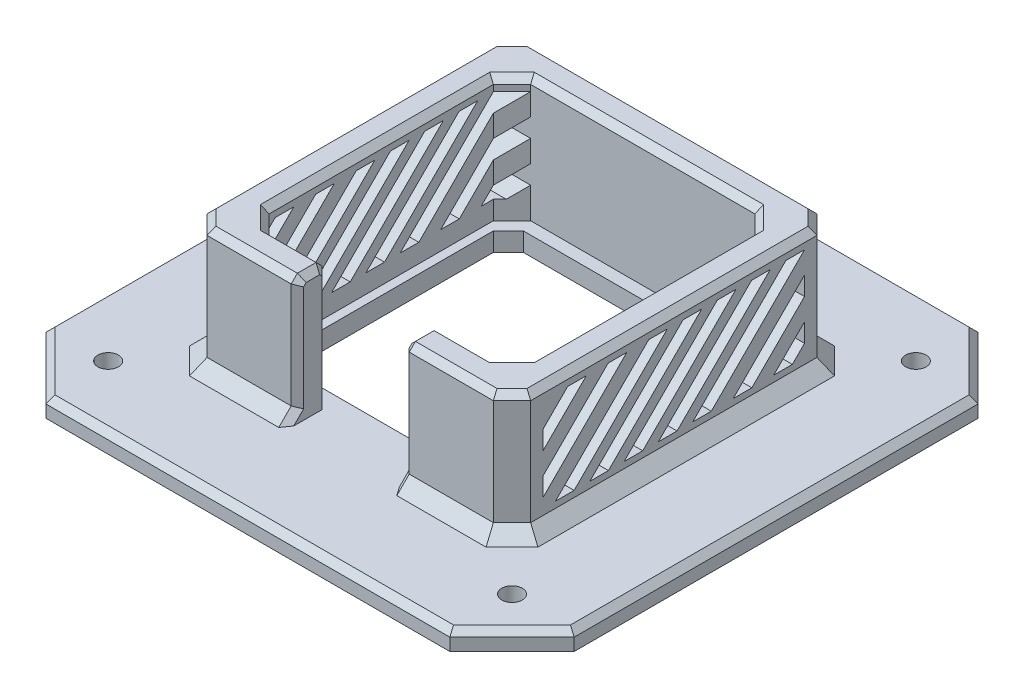
from build123d import *

# Parameters (mm, degrees)
SKETCH_1_W          = 85
SKETCH_1_H          = 85
EXTRUDE_1_DEPTH     = 3
SKETCH_2_W          = 52.08
SKETCH_2_H          = 52.08
SKETCH_2_W_2        = 42.08
SKETCH_2_H_2        = 42.08
EXTRUDE_2_DEPTH     = 20
CHAMFER_1_SIZE      = 3
CHAMFER_2_SIZE      = 2
CHAMFER_3_SIZE      = 1
CHAMFER_4_SIZE      = 10
CHAMFER_5_SIZE      = 1
CUT_EXTRUDE_1_REACH = 124.389
SKETCH_3_W          = 8.5
SKETCH_3_H          = 9.566393395
SKETCH_3_H_2        = 3
SKETCH_3_H_3        = 9.81159244
CHAMFER_6_SIZE      = 1
CUT_EXTRUDE_2_DEPTH = 10
CUT_EXTRUDE_4_DEPTH = 59
SKETCH_6_R          = 1.65
CUT_EXTRUDE_5_DEPTH = 10


with BuildPart() as part:
    # 草图1 → 凸台-拉伸1 (new body)
    with BuildSketch(Plane(origin=(0, 0, 0), x_dir=(1, 0, 0), z_dir=(0, 1, 0))):
        with Locations((42.5, 42.5)):
            Rectangle(SKETCH_1_W, SKETCH_1_H)
    extrude(amount=EXTRUDE_1_DEPTH)

    # 草图2 → 凸台-拉伸2 (add)
    with BuildSketch(Plane(origin=(0, 3, 0), x_dir=(1, 0, 0), z_dir=(0, 1, 0))):
        with Locations((42.5, 42.5)):
            Rectangle(SKETCH_2_W, SKETCH_2_H)
        with Locations((42.5, 42.5)):
            Rectangle(SKETCH_2_W_2, SKETCH_2_H_2, mode=Mode.SUBTRACT)
    extrude(amount=EXTRUDE_2_DEPTH)

    # 倒角1
    chamfer_1_edges = [part.edges().sort_by_distance(p)[0] for p in [
        (16.46, 13, -68.54),
        (16.46, 13, -16.46),
        (68.54, 13, -16.46),
        (68.54, 13, -68.54),
        (63.54, 13, -63.54),
        (21.46, 13, -63.54),
        (21.46, 13, -21.46),
        (63.54, 13, -21.46),
    ]]
    chamfer(chamfer_1_edges, length=CHAMFER_1_SIZE)

    # 倒角2
    chamfer_2_edges = [part.edges().sort_by_distance(p)[0] for p in [
        (68.54, 3, -42.5),
        (42.5, 3, -16.46),
        (42.5, 3, -68.54),
        (16.46, 3, -42.5),
        (67.04, 3, -17.96),
        (67.04, 3, -67.04),
        (17.96, 3, -17.96),
        (17.96, 3, -67.04),
    ]]
    chamfer(chamfer_2_edges, length=CHAMFER_2_SIZE)

    # 倒角3
    chamfer_3_edges = [part.edges().sort_by_distance(p)[0] for p in [
        (68.54, 23, -42.5),
        (42.5, 23, -16.46),
        (16.46, 23, -42.5),
        (42.5, 23, -68.54),
        (63.54, 23, -42.5),
        (42.5, 23, -21.46),
        (21.46, 23, -42.5),
        (42.5, 23, -63.54),
        (17.96, 23, -67.04),
        (17.96, 23, -17.96),
        (67.04, 23, -67.04),
        (67.04, 23, -17.96),
        (62.04, 23, -22.96),
        (22.96, 23, -22.96),
        (62.04, 23, -62.04),
        (22.96, 23, -62.04),
    ]]
    chamfer(chamfer_3_edges, length=CHAMFER_3_SIZE)

    # 倒角4
    chamfer_4_edges = [part.edges().sort_by_distance(p)[0] for p in [
        (0, 1.5, -85),
        (85, 1.5, -85),
        (85, 1.5, 0),
        (0, 1.5, 0),
    ]]
    chamfer(chamfer_4_edges, length=CHAMFER_4_SIZE)

    # 倒角5
    chamfer_5_edges = [part.edges().sort_by_distance(p)[0] for p in [
        (0, 3, -42.5),
        (42.5, 3, -85),
        (42.5, 3, 0),
        (85, 3, -42.5),
        (80, 3, -5),
        (80, 3, -80),
        (5, 3, -5),
        (5, 3, -80),
    ]]
    chamfer(chamfer_5_edges, length=CHAMFER_5_SIZE)

    # 切除-拉伸1: up to this face of the body (flat: up to its plane)
    cut_extrude_1_end = Plane(part.part.faces().sort_by_distance((42.5, 3, -42.5))[0])
    # 草图3 → 切除-拉伸1 (cut, up to the picked face)
    with BuildSketch(Plane(origin=(0, 23, 0), x_dir=(1, 0, 0), z_dir=(0, 1, 0)), mode=Mode.PRIVATE) as cut_extrude_1_sk1:
        with Locations((46.75, 12.676803303)):
            Rectangle(SKETCH_3_W, SKETCH_3_H)
    cut_extrude_1_tool1 = split(extrude(cut_extrude_1_sk1.sketch, amount=-CUT_EXTRUDE_1_REACH, mode=Mode.PRIVATE), bisect_by=cut_extrude_1_end, keep=Keep.BOTH, mode=Mode.PRIVATE)
    # 草图3 → 切除-拉伸1 (cut, up to the picked face)
    with BuildSketch(Plane(origin=(0, 23, 0), x_dir=(1, 0, 0), z_dir=(0, 1, 0)), mode=Mode.PRIVATE) as cut_extrude_1_sk2:
        with Locations((46.75, 18.96)):
            Rectangle(SKETCH_3_W, SKETCH_3_H_2)
    cut_extrude_1_tool2 = split(extrude(cut_extrude_1_sk2.sketch, amount=-CUT_EXTRUDE_1_REACH, mode=Mode.PRIVATE), bisect_by=cut_extrude_1_end, keep=Keep.BOTH, mode=Mode.PRIVATE)
    # 草图3 → 切除-拉伸1 (cut, up to the picked face)
    with BuildSketch(Plane(origin=(0, 23, 0), x_dir=(1, 0, 0), z_dir=(0, 1, 0)), mode=Mode.PRIVATE) as cut_extrude_1_sk3:
        with Locations((46.75, 25.36579622)):
            Rectangle(SKETCH_3_W, SKETCH_3_H_3)
    cut_extrude_1_tool3 = split(extrude(cut_extrude_1_sk3.sketch, amount=-CUT_EXTRUDE_1_REACH, mode=Mode.PRIVATE), bisect_by=cut_extrude_1_end, keep=Keep.BOTH, mode=Mode.PRIVATE)
    # 草图3 → 切除-拉伸1 (cut, up to the picked face)
    with BuildSketch(Plane(origin=(0, 23, 0), x_dir=(1, 0, 0), z_dir=(0, 1, 0)), mode=Mode.PRIVATE) as cut_extrude_1_sk4:
        with Locations((38.25, 25.36579622)):
            Rectangle(SKETCH_3_W, SKETCH_3_H_3)
    cut_extrude_1_tool4 = split(extrude(cut_extrude_1_sk4.sketch, amount=-CUT_EXTRUDE_1_REACH, mode=Mode.PRIVATE), bisect_by=cut_extrude_1_end, keep=Keep.BOTH, mode=Mode.PRIVATE)
    # 草图3 → 切除-拉伸1 (cut, up to the picked face)
    with BuildSketch(Plane(origin=(0, 23, 0), x_dir=(1, 0, 0), z_dir=(0, 1, 0)), mode=Mode.PRIVATE) as cut_extrude_1_sk5:
        with Locations((38.25, 18.96)):
            Rectangle(SKETCH_3_W, SKETCH_3_H_2)
    cut_extrude_1_tool5 = split(extrude(cut_extrude_1_sk5.sketch, amount=-CUT_EXTRUDE_1_REACH, mode=Mode.PRIVATE), bisect_by=cut_extrude_1_end, keep=Keep.BOTH, mode=Mode.PRIVATE)
    # 草图3 → 切除-拉伸1 (cut, up to the picked face)
    with BuildSketch(Plane(origin=(0, 23, 0), x_dir=(1, 0, 0), z_dir=(0, 1, 0)), mode=Mode.PRIVATE) as cut_extrude_1_sk6:
        with Locations((38.25, 12.676803303)):
            Rectangle(SKETCH_3_W, SKETCH_3_H)
    cut_extrude_1_tool6 = split(extrude(cut_extrude_1_sk6.sketch, amount=-CUT_EXTRUDE_1_REACH, mode=Mode.PRIVATE), bisect_by=cut_extrude_1_end, keep=Keep.BOTH, mode=Mode.PRIVATE)
    add(cut_extrude_1_tool1.solids().sort_by(Axis((46.75, 23, -12.676803), (0, -1, 0)))[0], mode=Mode.SUBTRACT)
    add(cut_extrude_1_tool2.solids().sort_by(Axis((46.75, 23, -18.96), (0, -1, 0)))[0], mode=Mode.SUBTRACT)
    add(cut_extrude_1_tool3.solids().sort_by(Axis((46.75, 23, -25.365796), (0, -1, 0)))[0], mode=Mode.SUBTRACT)
    add(cut_extrude_1_tool4.solids().sort_by(Axis((38.25, 23, -25.365796), (0, -1, 0)))[0], mode=Mode.SUBTRACT)
    add(cut_extrude_1_tool5.solids().sort_by(Axis((38.25, 23, -18.96), (0, -1, 0)))[0], mode=Mode.SUBTRACT)
    add(cut_extrude_1_tool6.solids().sort_by(Axis((38.25, 23, -12.676803), (0, -1, 0)))[0], mode=Mode.SUBTRACT)

    # 倒角6
    chamfer_6_edges = [part.edges().sort_by_distance(p)[0] for p in [
        (34, 22.5, -16.96),
        (51, 22.5, -16.96),
        (51, 12.5, -21.46),
        (51, 22.5, -20.96),
        (51, 23, -18.96),
        (34, 12.5, -21.46),
        (34, 22.5, -20.96),
        (34, 4, -15.46),
        (34, 13.5, -16.46),
        (51, 4, -15.46),
        (51, 13.5, -16.46),
        (34, 23, -18.96),
    ]]
    chamfer(chamfer_6_edges, length=CHAMFER_6_SIZE)

    # 草图4 → 切除-拉伸2 (cut)
    with BuildSketch(Plane(origin=(0, 3, 0), x_dir=(1, 0, 0), z_dir=(0, 1, 0))):
        Polygon((25.288427125, 61.54), (22.874213562, 59.125786438), (22.874213562, 25.874213562), (25.288427125, 23.46), (33, 23.46), (52, 23.46), (59.711572875, 23.46), (61.54, 25.288427125), (61.54, 59.711572875), (59.711572875, 61.54), align=None)
    extrude(amount=-CUT_EXTRUDE_2_DEPTH, mode=Mode.SUBTRACT)

    # 草图5 → 切除-拉伸4 (cut)
    with BuildSketch(Plane.ZY.offset(-16.46)):
        Polygon((-63.54, 10.96), (-63.54, 7.96), (-61.58, 6), (-58.58, 6), align=None)
        Polygon((-63.54, 17.48), (-63.54, 14.48), (-55.06, 6), (-52.06, 6), align=None)
        Polygon((-45.54, 6), (-60.54, 21), (-63.54, 21), (-48.54, 6), align=None)
        Polygon((-40.02, 6), (-55.02, 21), (-58.02, 21), (-43.02, 6), align=None)
        Polygon((-34.5, 6), (-49.5, 21), (-52.5, 21), (-37.5, 6), align=None)
        Polygon((-28.98, 6), (-43.98, 21), (-46.98, 21), (-31.98, 6), align=None)
        Polygon((-23.46, 6), (-38.46, 21), (-41.46, 21), (-26.46, 6), align=None)
        Polygon((-21.46, 7.52), (-21.46, 10.52), (-31.94, 21), (-34.94, 21), align=None)
        Polygon((-21.46, 14.04), (-21.46, 17.04), (-25.42, 21), (-28.42, 21), align=None)
    extrude(amount=-CUT_EXTRUDE_4_DEPTH, mode=Mode.SUBTRACT)

    # 草图6 → 切除-拉伸5 (cut)
    with BuildSketch(Plane.XZ):
        with Locations(Location((75, -10, 0), (0, 0, 270))):
            Circle(SKETCH_6_R)
        with Locations(Location((75, -75, 0), (0, 0, 270))):
            Circle(SKETCH_6_R)
        with Locations(Location((10, -75, 0), (0, 0, 270))):
            Circle(SKETCH_6_R)
        with Locations(Location((10, -10, 0), (0, 0, 270))):
            Circle(SKETCH_6_R)
    extrude(amount=-CUT_EXTRUDE_5_DEPTH, mode=Mode.SUBTRACT)


solid = part.part
